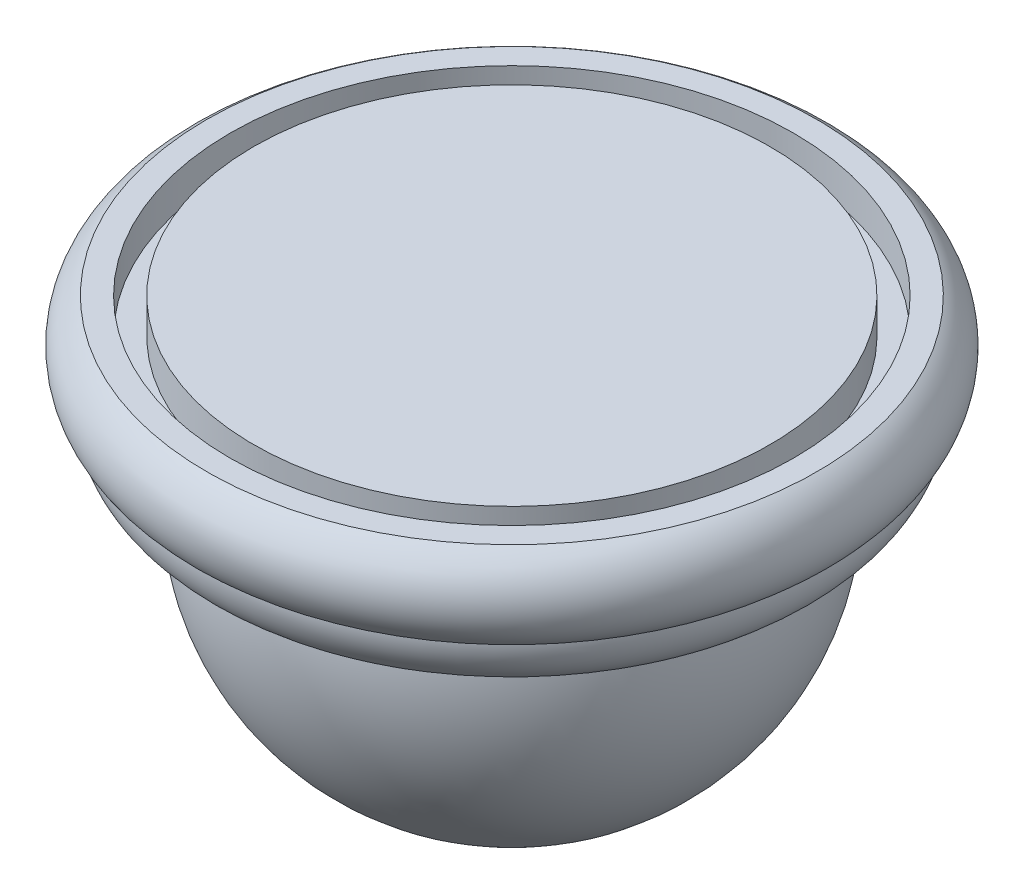
from build123d import *


with BuildPart() as part:
    # Sketch2 → Revolve1 (revolve)
    with BuildSketch(Plane.XY, mode=Mode.PRIVATE) as revolve1_sk:
        with BuildLine():
            Line((38.1, 7.9375), (34.925, 7.9375))
            Line((34.925, 7.9375), (34.925, 12.7))
            Line((34.925, 12.7), (0, 12.7))
            Line((0, 12.7), (0, 0))
            Line((0, 0), (0, -44.45))
            ThreePointArc((0, -44.45), (25.664225243, -32.512774616), (33.069273235, -5.194006865))
            ThreePointArc((33.069273235, -5.194006865), (39.309985781, -4.181816741), (42.036043974, 1.52253499))
            ThreePointArc((42.036043974, 1.52253499), (44.580012514, 7.310388306), (41.275, 12.7))
            Line((41.275, 12.7), (38.1, 12.7))
            Line((38.1, 12.7), (38.1, 7.9375))
        make_face()
    revolve(revolve1_sk.sketch.rotate(Axis((0, 12.7, 0), (0, -1, 0)), 180), axis=Axis((0, 12.7, 0), (0, -1, 0)))


solid = part.part
